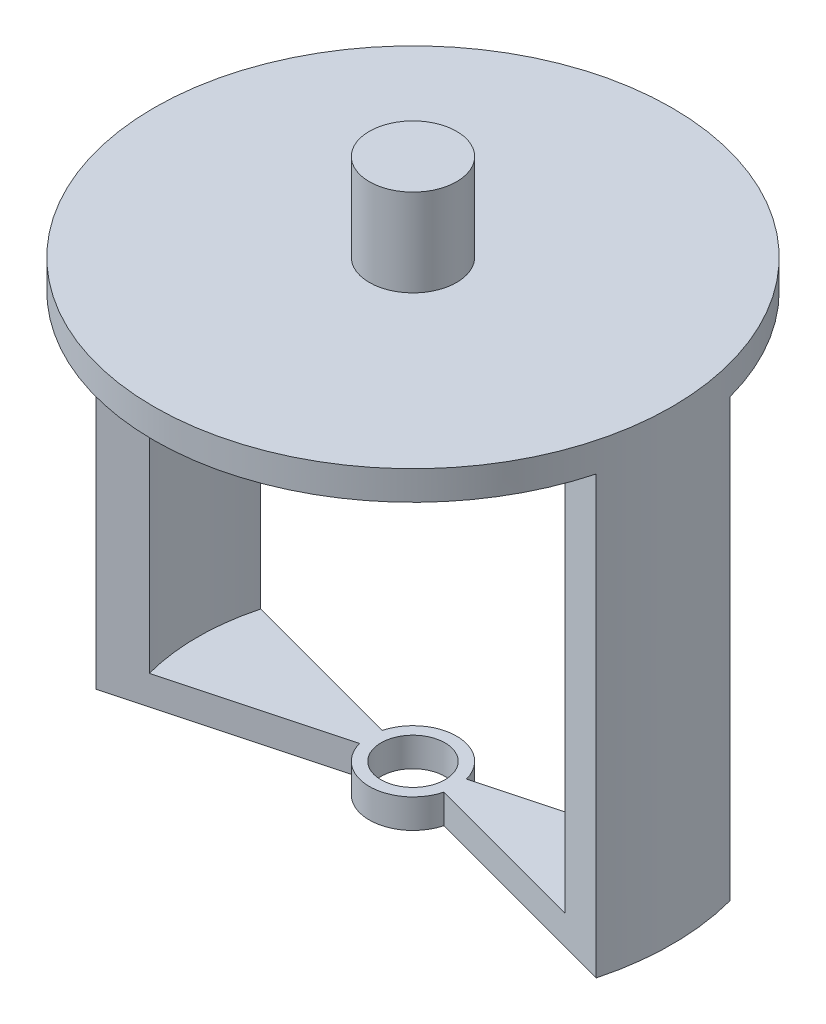
from build123d import *

# Parameters (mm, degrees)
SALIENTE_EXTRUIR1_DEPTH      = 40
SALIENTE_EXTRUIR1_DEPTH_BACK = 40
CROQUIS1_R                   = 44.5
CORTAR_EXTRUIR1_DEPTH        = 35
CORTAR_EXTRUIR1_DEPTH_BACK   = 35
CROQUIS2_OUTSIDE_W           = 120.828
CROQUIS2_OUTSIDE_H           = 120.828
CORTAR_EXTRUIR2_REACH        = 99.906
CROQUIS3_R                   = 5.5
SALIENTE_EXTRUIR2_START      = 15
CROQUIS4_R                   = 7.5
SALIENTE_EXTRUIR2_DEPTH      = 15


with BuildPart() as part:
    # Croquis1 → Saliente-Extruir1 (new, two sides: drawn at the far end of the back side and taken through both)
    with BuildSketch(Plane(origin=(0, 0, 0), x_dir=(1, 0, 0), z_dir=(0, 1, 0)).offset(-SALIENTE_EXTRUIR1_DEPTH_BACK)):
        Circle(CROQUIS1_R)
    extrude(amount=SALIENTE_EXTRUIR1_DEPTH + SALIENTE_EXTRUIR1_DEPTH_BACK)

    # Croquis2 outside → Cortar-Extruir1 (cut, two sides: drawn at the far end of the back side and taken through both)
    with BuildSketch(Plane(origin=(0, 0, 0), x_dir=(1, 0, 0), z_dir=(0, 1, 0)).offset(-CORTAR_EXTRUIR1_DEPTH_BACK)):
        Rectangle(CROQUIS2_OUTSIDE_W, CROQUIS2_OUTSIDE_H)
        with BuildLine():
            Line((35.739256, 9.576305), (42.983699, 11.517448))
            ThreePointArc((42.983699, 11.517448), (44.5, 0), (42.983699, -11.517448))
            Line((42.983699, -11.517448), (35.739256, -9.576305))
            ThreePointArc((35.739256, -9.576305), (37, 0), (35.739256, 9.576305))
        make_face(mode=Mode.SUBTRACT)
        with BuildLine():
            Line((-35.739256, -9.576305), (-42.983699, -11.517448))
            ThreePointArc((-42.983699, -11.517448), (-44.5, 0), (-42.983699, 11.517448))
            Line((-42.983699, 11.517448), (-35.739256, 9.576305))
            ThreePointArc((-35.739256, 9.576305), (-37, 0), (-35.739256, -9.576305))
        make_face(mode=Mode.SUBTRACT)
    extrude(amount=CORTAR_EXTRUIR1_DEPTH + CORTAR_EXTRUIR1_DEPTH_BACK, mode=Mode.SUBTRACT)

    # Croquis3 → Cortar-Extruir2 (cut, up to next)
    with BuildSketch(Plane(origin=(0, -35, 0), x_dir=(1, 0, 0), z_dir=(0, 1, 0)), mode=Mode.PRIVATE) as cortar_extruir2_sk1:
        with BuildLine():
            Line((7.244444, 1.941143), (42.983699, 11.517448))
            ThreePointArc((42.983699, 11.517448), (0, 44.5), (-42.983699, 11.517448))
            Line((-42.983699, 11.517448), (-7.244444, 1.941143))
            ThreePointArc((-7.244444, 1.941143), (0, 7.5), (7.244444, 1.941143))
        make_face()
    cortar_extruir2_tool1 = extrude(cortar_extruir2_sk1.sketch, amount=-CORTAR_EXTRUIR2_REACH, mode=Mode.PRIVATE) & part.part
    # Croquis3 → Cortar-Extruir2 (cut, up to next)
    with BuildSketch(Plane(origin=(0, -35, 0), x_dir=(1, 0, 0), z_dir=(0, 1, 0)), mode=Mode.PRIVATE) as cortar_extruir2_sk2:
        with BuildLine():
            ThreePointArc((-42.983699, -11.517448), (0, -44.5), (42.983699, -11.517448))
            Line((42.983699, -11.517448), (7.244444, -1.941143))
            ThreePointArc((7.244444, -1.941143), (0, -7.5), (-7.244444, -1.941143))
            Line((-7.244444, -1.941143), (-42.983699, -11.517448))
        make_face()
    cortar_extruir2_tool2 = extrude(cortar_extruir2_sk2.sketch, amount=-CORTAR_EXTRUIR2_REACH, mode=Mode.PRIVATE) & part.part
    # Croquis3 → Cortar-Extruir2 (cut, up to next)
    with BuildSketch(Plane(origin=(0, -35, 0), x_dir=(1, 0, 0), z_dir=(0, 1, 0)), mode=Mode.PRIVATE) as cortar_extruir2_sk3:
        Circle(CROQUIS3_R)
    cortar_extruir2_tool3 = extrude(cortar_extruir2_sk3.sketch, amount=-CORTAR_EXTRUIR2_REACH, mode=Mode.PRIVATE) & part.part
    add(cortar_extruir2_tool1.solids().sort_by_distance((0, -35, -22.423567))[0], mode=Mode.SUBTRACT)
    add(cortar_extruir2_tool2.solids().sort_by_distance((0, -35, 22.423567))[0], mode=Mode.SUBTRACT)
    add(cortar_extruir2_tool3.solids().sort_by_distance((0, -35, 0))[0], mode=Mode.SUBTRACT)

    # Croquis4 → Saliente-Extruir2 (add)
    with BuildSketch(Plane(origin=(0, 40, 0), x_dir=(1, 0, 0), z_dir=(0, 1, 0)).offset(SALIENTE_EXTRUIR2_START)):
        Circle(CROQUIS4_R)
    extrude(amount=-SALIENTE_EXTRUIR2_DEPTH)


solid = part.part
